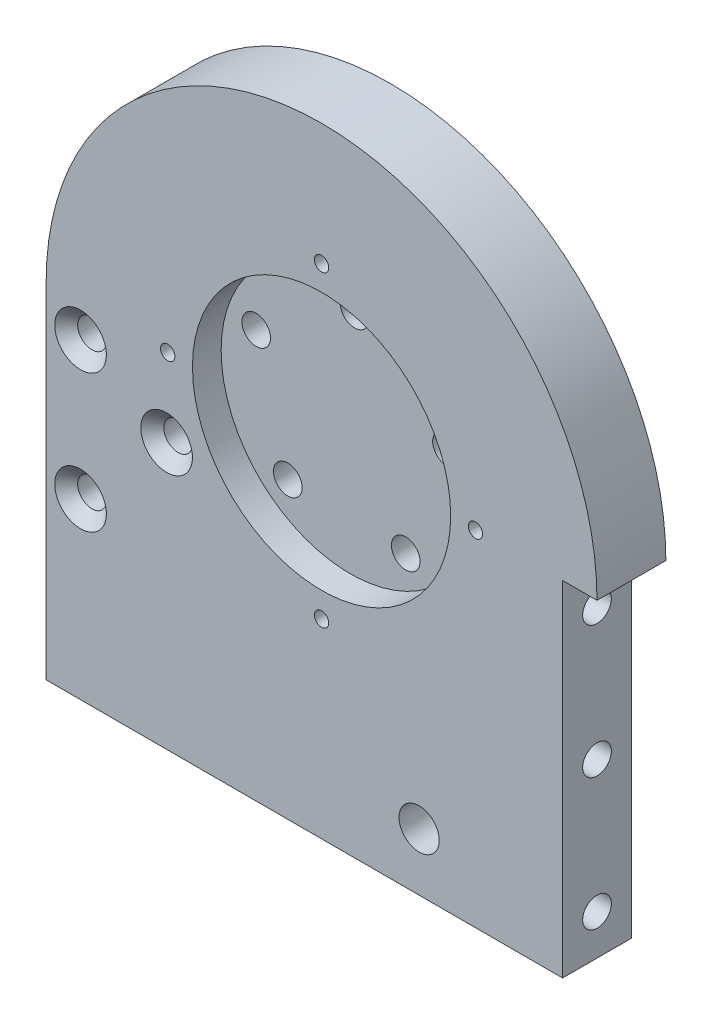
from build123d import *

# Parameters (mm, degrees)
BOSS_EXTRUDE1_DEPTH                             = 12
SKETCH2_R                                       = 22.5
CUT_EXTRUDE1_DEPTH                              = 5
SKETCH3_R                                       = 2.5
CUT_EXTRUDE2_DEPTH                              = 94.45587194
CIRPATTERN1_COUNT                               = 5
SKETCH4_R                                       = 1.25
CUT_EXTRUDE3_DEPTH                              = 94.96275858
CIRPATTERN2_COUNT                               = 4
SKETCH11_R                                      = 3.5
CUT_EXTRUDE8_DEPTH                              = 14.5
SKETCH13_R                                      = 3.25
CUT_EXTRUDE9_DEPTH                              = 8
LPATTERN2_COUNT                                 = 2
LPATTERN2_PITCH                                 = 28.2
SKETCH14_R                                      = 2.5
CUT_EXTRUDE10_DEPTH                             = 8
LPATTERN3_COUNT                                 = 3
LPATTERN3_PITCH                                 = 23
CSK_FOR_M5_FLAT_HEAD_MACHINE_SCREW1_D           = 5
CSK_FOR_M5_FLAT_HEAD_MACHINE_SCREW1_CSINK_D     = 9
CSK_FOR_M5_FLAT_HEAD_MACHINE_SCREW1_CSINK_ANGLE = 90


with BuildPart() as part:
    # Sketch1 → Boss-Extrude1 (new body)
    with BuildSketch(Plane.XY):
        with BuildLine():
            Line((45, 30), (51, 30))
            ThreePointArc((51, 30), (3, 78), (-45, 30))
            Line((-45, 30), (-45, -30))
            Line((-45, -30), (45, -30))
            Line((45, -30), (45, 30))
        make_face()
    extrude(amount=BOSS_EXTRUDE1_DEPTH)

    # Sketch2 → Cut-Extrude1 (cut)
    with BuildSketch(Plane.XY.offset(12)):
        with Locations((3, 30)):
            Circle(SKETCH2_R)
    extrude(amount=-CUT_EXTRUDE1_DEPTH, mode=Mode.SUBTRACT)

    # Sketch3 → Cut-Extrude2 (cut, through all)
    with BuildSketch(Plane.XY.offset(7)):
        with Locations((3.751645972, 47.483850501)):
            Circle(SKETCH3_R)
    cut_extrude2 = extrude(amount=-CUT_EXTRUDE2_DEPTH, mode=Mode.SUBTRACT)

    # CirPattern1: Cut-Extrude2 ×5 about axis
    cirpattern1_axis = Axis((3, 30, 0), (0, 0, 1))
    for i in range(1, CIRPATTERN1_COUNT):
        add(cut_extrude2.rotate(cirpattern1_axis, i * 360 / CIRPATTERN1_COUNT), mode=Mode.SUBTRACT)

    # Sketch4 → Cut-Extrude3 (cut, through all)
    with BuildSketch(Plane.XY.offset(12)):
        with Locations((3, 56.81356815)):
            Circle(SKETCH4_R)
    cut_extrude3 = extrude(amount=-CUT_EXTRUDE3_DEPTH, mode=Mode.SUBTRACT)

    # CirPattern2: Cut-Extrude3 ×4 about axis
    cirpattern2_axis = Axis((3, 30, 0), (0, 0, 1))
    for i in range(1, CIRPATTERN2_COUNT):
        add(cut_extrude3.rotate(cirpattern2_axis, i * 360 / CIRPATTERN2_COUNT), mode=Mode.SUBTRACT)

    # Sketch11 → Cut-Extrude8 (cut)
    with BuildSketch(Plane.XY.offset(12)):
        with Locations((20, -20)):
            Circle(SKETCH11_R)
    extrude(amount=-CUT_EXTRUDE8_DEPTH, mode=Mode.SUBTRACT)

    # Sketch13 → Cut-Extrude9 (cut)
    with BuildSketch(Plane.XZ.offset(30)):
        with Locations(Location((-36.7, 5.2, 0), (0, 0, 270))):
            Circle(SKETCH13_R)
    cut_extrude9 = extrude(amount=-CUT_EXTRUDE9_DEPTH, mode=Mode.SUBTRACT)

    # LPattern2: Cut-Extrude9 ×2
    with Locations(*[(i * LPATTERN2_PITCH, 0, 0) for i in range(1, LPATTERN2_COUNT)]):
        add(cut_extrude9, mode=Mode.SUBTRACT)

    # Sketch14 → Cut-Extrude10 (cut)
    with BuildSketch(Plane(origin=(45, 0, 0), x_dir=(0, 0, -1), z_dir=(1, 0, 0))):
        with Locations((-6, -23)):
            Circle(SKETCH14_R)
    cut_extrude10 = extrude(amount=-CUT_EXTRUDE10_DEPTH, mode=Mode.SUBTRACT)

    # LPattern3: Cut-Extrude10 ×3
    with Locations(*[(0, i * LPATTERN3_PITCH, 0) for i in range(1, LPATTERN3_COUNT)]):
        add(cut_extrude10, mode=Mode.SUBTRACT)

    # CSK for M5 Flat Head Machine Screw1 (through all)
    with Locations(Plane.XY.offset(12)):
        with Locations((-39, 24.3), (-39, 0.3), (-24, 16.3)):
            CounterSinkHole(CSK_FOR_M5_FLAT_HEAD_MACHINE_SCREW1_D / 2, CSK_FOR_M5_FLAT_HEAD_MACHINE_SCREW1_CSINK_D / 2, counter_sink_angle=CSK_FOR_M5_FLAT_HEAD_MACHINE_SCREW1_CSINK_ANGLE)


solid = part.part
